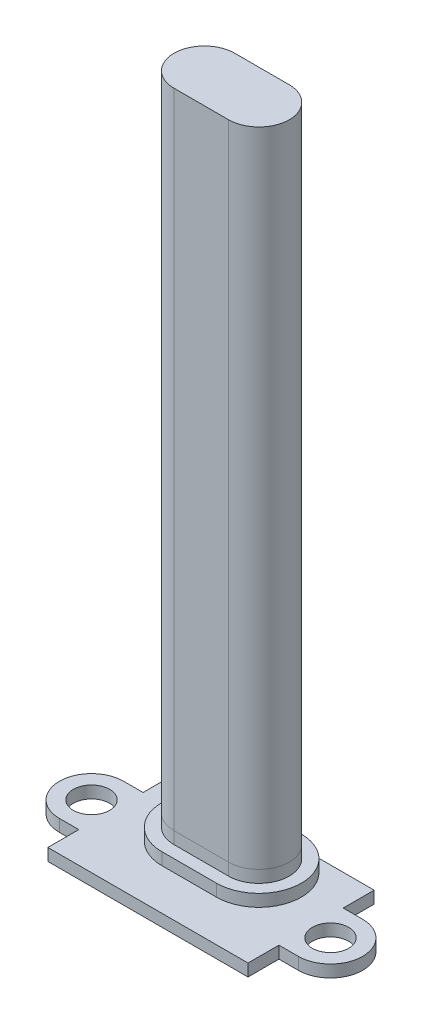
from build123d import *

# Parameters (mm, degrees)
SKETCH1_R           = 1.5
BOSS_EXTRUDE1_DEPTH = 1
BOSS_EXTRUDE2_DEPTH = 1
BOSS_EXTRUDE4_DEPTH = 1
BOSS_EXTRUDE5_DEPTH = 53


with BuildPart() as part:
    # Sketch1 → Boss-Extrude1 (new body)
    with BuildSketch(Plane(origin=(0, 0, 0), x_dir=(1, 0, 0), z_dir=(0, 1, 0))):
        with BuildLine():
            Line((-8.25, 0), (8.25, 0))
            Line((8.25, 0), (8.25, 2.55))
            Line((8.25, 2.55), (9.85, 2.55))
            ThreePointArc((9.85, 2.55), (12.5, 5.2), (9.85, 7.85))
            Line((9.85, 7.85), (8.25, 7.85))
            Line((8.25, 7.85), (8.25, 10.4))
            Line((8.25, 10.4), (-8.25, 10.4))
            Line((-8.25, 10.4), (-8.25, 7.85))
            Line((-8.25, 7.85), (-9.85, 7.85))
            ThreePointArc((-9.85, 7.85), (-12.5, 5.2), (-9.85, 2.55))
            Line((-9.85, 2.55), (-8.25, 2.55))
            Line((-8.25, 2.55), (-8.25, 0))
        make_face()
        with Locations(Location((9.85, 5.2, 0), (0, 0, 270))):
            Circle(SKETCH1_R, mode=Mode.SUBTRACT)
        with Locations(Location((-9.85, 5.2, 0), (0, 0, 270))):
            Circle(SKETCH1_R, mode=Mode.SUBTRACT)
    extrude(amount=BOSS_EXTRUDE1_DEPTH)


with BuildPart() as body_2:
    # Sketch2 → Boss-Extrude2 (new body)
    with BuildSketch(Plane(origin=(0, 1, 0), x_dir=(1, 0, 0), z_dir=(0, 1, 0))):
        with BuildLine():
            Line((-2.25, 10.4), (2.25, 10.4))
            ThreePointArc((2.25, 10.4), (5.75, 6.9), (2.25, 3.4))
            Line((2.25, 3.4), (-2.25, 3.4))
            ThreePointArc((-2.25, 3.4), (-5.75, 6.9), (-2.25, 10.4))
        make_face()
    extrude(amount=BOSS_EXTRUDE2_DEPTH)

    # Sketch3 → Boss-Extrude4 (add)
    with BuildSketch(Plane(origin=(0, 2, 0), x_dir=(1, 0, 0), z_dir=(0, 1, 0))):
        with BuildLine():
            Line((-2.25, 4.4), (2.25, 4.4))
            ThreePointArc((2.25, 4.4), (4.75, 6.9), (2.25, 9.4))
            Line((2.25, 9.4), (-2.25, 9.4))
            ThreePointArc((-2.25, 9.4), (-4.75, 6.9), (-2.25, 4.4))
        make_face()
    extrude(amount=BOSS_EXTRUDE4_DEPTH)


with BuildPart() as body_3:
    # Sketch4 → Boss-Extrude5 (new body)
    with BuildSketch(Plane(origin=(0, 3, 0), x_dir=(1, 0, 0), z_dir=(0, 1, 0))):
        with BuildLine():
            Line((-2.25, 4.4), (2.25, 4.4))
            ThreePointArc((2.25, 4.4), (4.75, 6.9), (2.25, 9.4))
            Line((2.25, 9.4), (-2.25, 9.4))
            ThreePointArc((-2.25, 9.4), (-4.75, 6.9), (-2.25, 4.4))
        make_face()
    extrude(amount=BOSS_EXTRUDE5_DEPTH)


solid = Compound([part.part, body_2.part, body_3.part])
